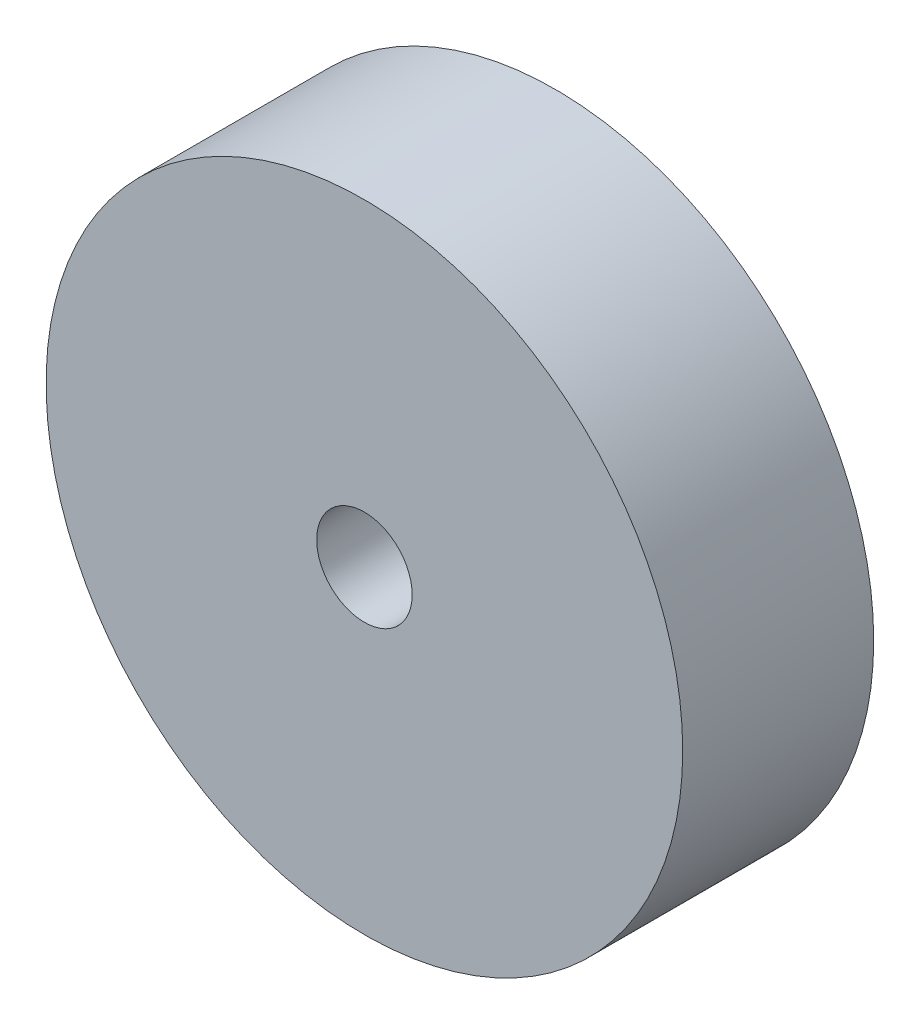
from build123d import *

# Parameters (mm, degrees)
SKETCH1_R           = 5
SKETCH1_R_2         = 0.75
BOSS_EXTRUDE1_DEPTH = 3


with BuildPart() as part:
    # Sketch1 → Boss-Extrude1 (new body)
    with BuildSketch(Plane.XY):
        Circle(SKETCH1_R)
        Circle(SKETCH1_R_2, mode=Mode.SUBTRACT)
    extrude(amount=BOSS_EXTRUDE1_DEPTH)


solid = part.part
